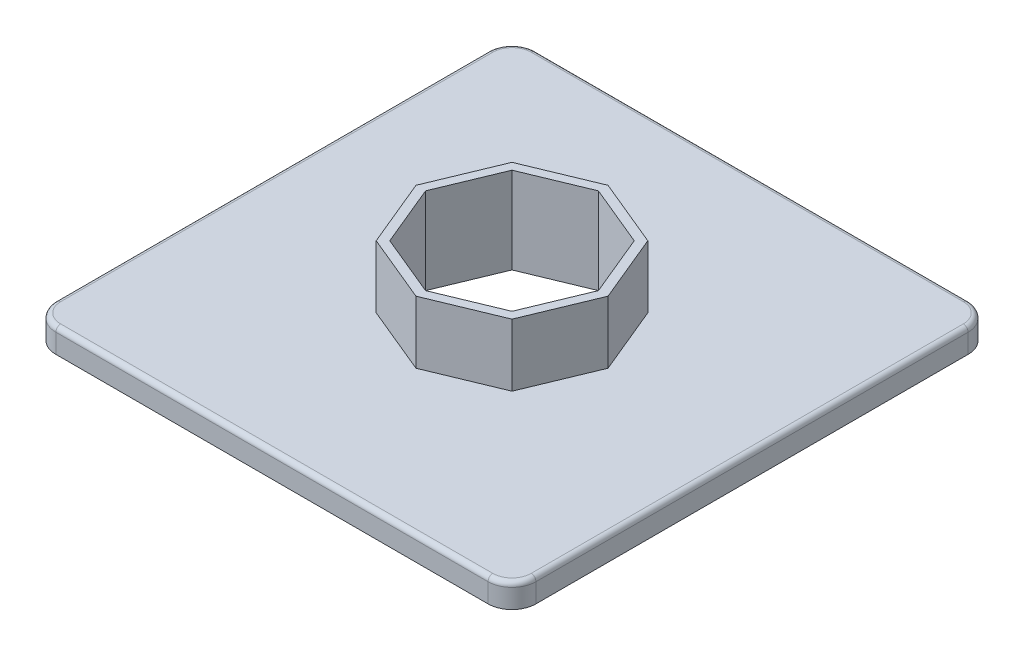
from build123d import *

# Parameters (mm, degrees)
BOSS_EXTRUDE1_DEPTH = 5
FILLET1_R           = 1
BOSS_EXTRUDE2_DEPTH = 13
CUT_EXTRUDE1_DEPTH  = 143.017604543


with BuildPart() as part:
    # Sketch1 → Boss-Extrude1 (new body)
    with BuildSketch(Plane(origin=(0, 0, 0), x_dir=(1, 0, 0), z_dir=(0, 1, 0))):
        with BuildLine():
            Line((5, 0), (95, 0))
            ThreePointArc((95, 0), (98.535533906, 1.464466094), (100, 5))
            Line((100, 5), (100, 95))
            ThreePointArc((100, 95), (98.535533906, 98.535533906), (95, 100))
            Line((95, 100), (5, 100))
            ThreePointArc((5, 100), (1.464466094, 98.535533906), (0, 95))
            Line((0, 95), (0, 5))
            ThreePointArc((0, 5), (1.464466094, 1.464466094), (5, 0))
        make_face()
    extrude(amount=BOSS_EXTRUDE1_DEPTH)

    # Fillet1
    fillet1_edges = [part.edges().sort_by_distance(p)[0] for p in [
        (1.464466094, 5, -98.535533906),
        (0, 5, -50),
        (1.464466094, 5, -1.464466094),
        (50, 5, 0),
        (98.535533906, 5, -1.464466094),
        (100, 5, -50),
        (98.535533906, 5, -98.535533906),
        (50, 5, -100),
    ]]
    fillet(fillet1_edges, radius=FILLET1_R)

    # Sketch2 → Boss-Extrude2 (add)
    with BuildSketch(Plane(origin=(0, 5, 0), x_dir=(1, 0, 0), z_dir=(0, 1, 0))):
        Polygon((70, 50), (64.142135624, 64.142135624), (50, 70), (35.857864376, 64.142135624), (30, 50), (35.857864376, 35.857864376), (50, 30), (64.142135624, 35.857864376), align=None)
        Polygon((68, 50), (62.727922061, 62.727922061), (50, 68), (37.272077939, 62.727922061), (32, 50), (37.272077939, 37.272077939), (50, 32), (62.727922061, 37.272077939), align=None, mode=Mode.SUBTRACT)
    extrude(amount=BOSS_EXTRUDE2_DEPTH)

    # Sketch5 → Cut-Extrude1 (cut, through all)
    with BuildSketch(Plane(origin=(0, 5, 0), x_dir=(1, 0, 0), z_dir=(0, 1, 0))):
        Polygon((68, 50), (62.727922061, 62.727922061), (50, 68), (37.272077939, 62.727922061), (32, 50), (37.272077939, 37.272077939), (50, 32), (62.727922061, 37.272077939), align=None)
    extrude(amount=-CUT_EXTRUDE1_DEPTH, mode=Mode.SUBTRACT)


solid = part.part
